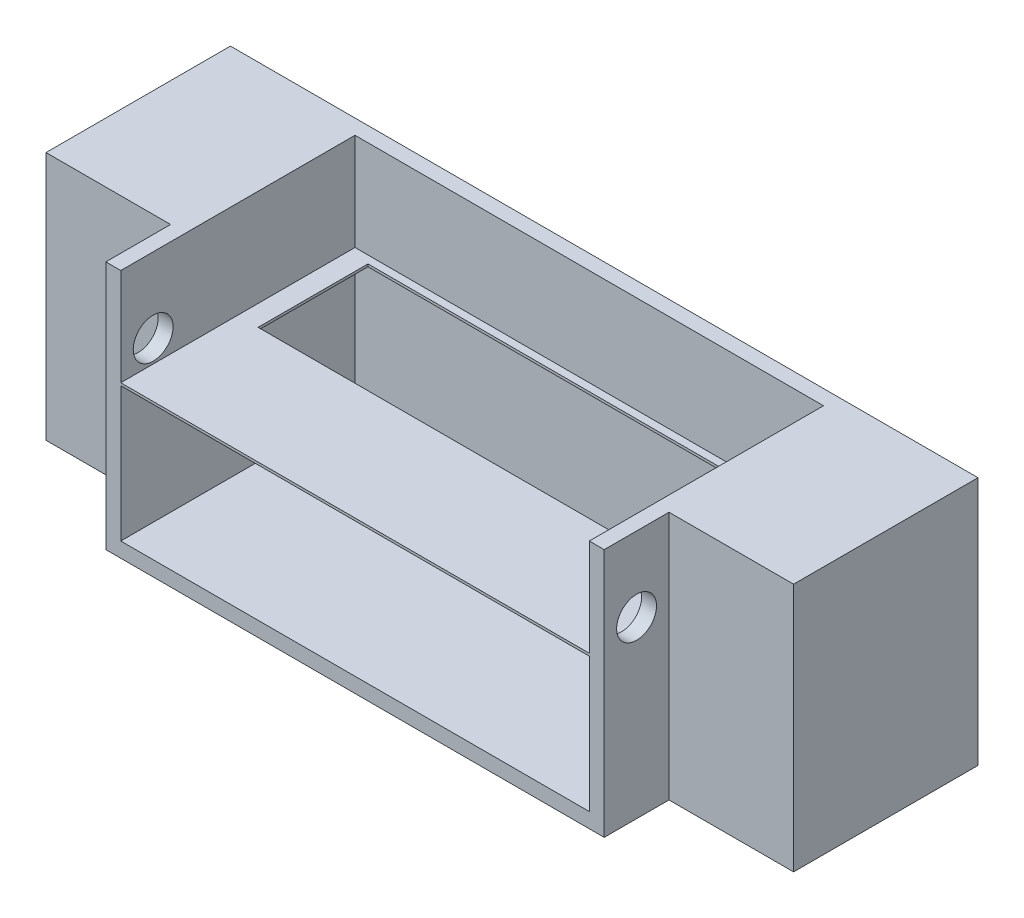
from build123d import *

# Parameters (mm, degrees)
SKETCH1_W           = 100
SKETCH1_H           = 40
BOSS_EXTRUDE1_DEPTH = 50
SKETCH2_W           = 94
SKETCH2_H           = 47
CUT_EXTRUDE1_DEPTH  = 37
SKETCH3_W           = 37
SKETCH3_H           = 40
BOSS_EXTRUDE2_DEPTH = 25
SKETCH4_R           = 4
CUT_EXTRUDE2_DEPTH  = 137.106575888
BOSS_EXTRUDE3_DEPTH = 10
BOSS_EXTRUDE4_REACH = 97
SKETCH7_W           = 94
SKETCH7_H           = 0.5
CUT_EXTRUDE3_REACH  = 97.159
SKETCH8_W           = 85.699881722
SKETCH8_H           = 22.040366035


with BuildPart() as part:
    # Sketch1 → Boss-Extrude1 (new body)
    with BuildSketch(Plane.XY):
        Rectangle(SKETCH1_W, SKETCH1_H)
    extrude(amount=-BOSS_EXTRUDE1_DEPTH)

    # Sketch2 → Cut-Extrude1 (cut)
    with BuildSketch(Plane(origin=(0, 20, 0), x_dir=(1, 0, 0), z_dir=(0, 1, 0))):
        with Locations((0, 23.5)):
            Rectangle(SKETCH2_W, SKETCH2_H)
    extrude(amount=-CUT_EXTRUDE1_DEPTH, mode=Mode.SUBTRACT)

    # Sketch3 → Boss-Extrude2 (add)
    with BuildSketch(Plane(origin=(50, 0, 0), x_dir=(0, 0, -1), z_dir=(1, 0, 0))):
        with Locations((31.5, 0)):
            Rectangle(SKETCH3_W, SKETCH3_H)
    boss_extrude2 = extrude(amount=BOSS_EXTRUDE2_DEPTH)

    # Mirror2: Boss-Extrude2 across plane
    add(boss_extrude2.mirror(Plane.ZY))

    # Sketch4 → Cut-Extrude2 (cut, through all)
    with BuildSketch(Plane.ZY.offset(50)):
        with Locations(Location((-6.5, 15, 0), (0, 0, 90))):
            Circle(SKETCH4_R)
    extrude(amount=-CUT_EXTRUDE2_DEPTH, mode=Mode.SUBTRACT)

    # Sketch6 → Boss-Extrude3 (add)
    with BuildSketch(Plane(origin=(0, 20, 0), x_dir=(1, 0, 0), z_dir=(0, 1, 0))):
        Polygon((-47, 0), (-47, 47), (47, 47), (47, 0), (50, 0), (50, 13), (75, 13), (75, 50), (-75, 50), (-75, 13), (-50, 13), (-50, 0), align=None)
    extrude(amount=BOSS_EXTRUDE3_DEPTH)

    # Sketch7 → Boss-Extrude4 (add, up to next)
    with BuildSketch(Plane.XY, mode=Mode.PRIVATE) as boss_extrude4_sk1:
        with Locations((0, 10.25)):
            Rectangle(SKETCH7_W, SKETCH7_H)
    boss_extrude4_tool1 = extrude(boss_extrude4_sk1.sketch, amount=-BOSS_EXTRUDE4_REACH, mode=Mode.PRIVATE) - part.part
    add(boss_extrude4_tool1.solids().sort_by_distance((0, 10.25, 0))[0])

    # Sketch8 → Cut-Extrude3 (cut, up to next)
    with BuildSketch(Plane(origin=(0, 10.5, 0), x_dir=(1, 0, 0), z_dir=(0, 1, 0)), mode=Mode.PRIVATE) as cut_extrude3_sk1:
        with Locations((0, 34.43157355)):
            Rectangle(SKETCH8_W, SKETCH8_H)
    cut_extrude3_tool1 = extrude(cut_extrude3_sk1.sketch, amount=-CUT_EXTRUDE3_REACH, mode=Mode.PRIVATE) & part.part
    add(cut_extrude3_tool1.solids().sort_by_distance((0, 10.5, -34.431574))[0], mode=Mode.SUBTRACT)


solid = part.part
